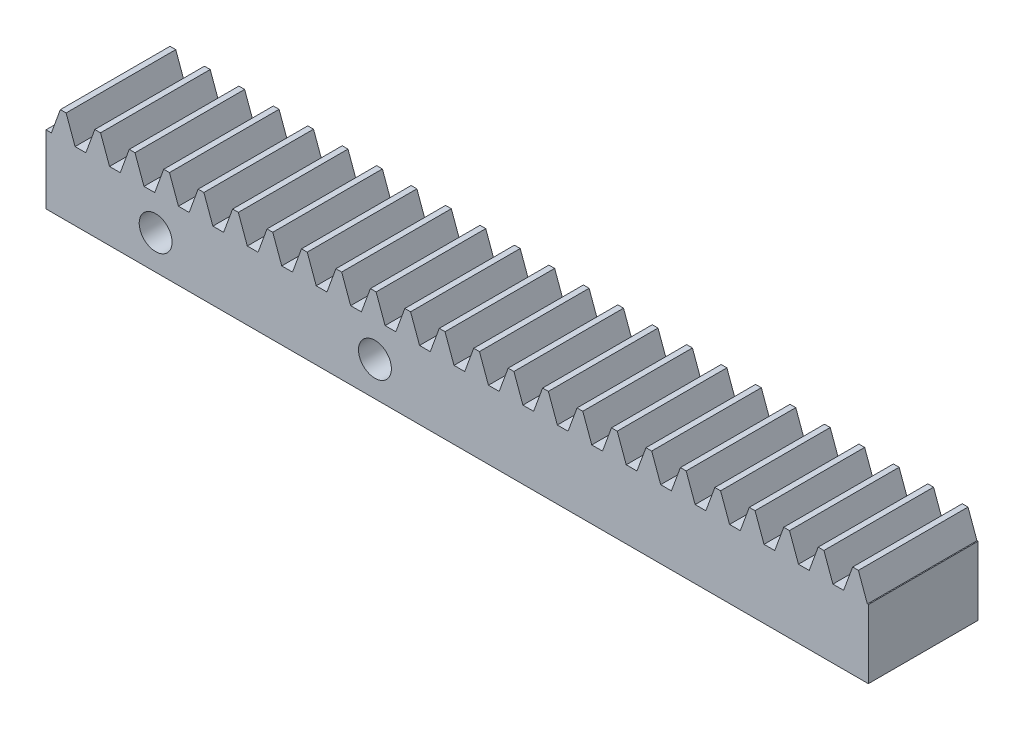
from build123d import *

# Parameters (mm, degrees)
BLANKSKE_W         = 75
BLANKSKE_H         = 8.5
BLANK_DEPTH        = 10
TOOTHCUTSIM_DEPTH  = 77.139674284
TEETHCUTS_COUNT    = 25
TEETHCUTS_PITCH    = 3.14159265
SKETCH1_R          = 1.5
CUT_EXTRUDE1_DEPTH = 10


with BuildPart() as part:
    # BlankSke → Blank (new body)
    with BuildSketch(Plane.XY):
        with Locations((37.5, 4.25)):
            Rectangle(BLANKSKE_W, BLANKSKE_H)
    extrude(amount=-BLANK_DEPTH)

    # TooCutSkeSim → ToothCutSim (cut, through all)
    with BuildSketch(Plane.XY):
        Polygon((0.48943537, 6.25), (-0.48943537, 6.25), (-1.317613241, 8.5254), (1.317613241, 8.5254), align=None)
    toothcutsim = extrude(amount=-TOOTHCUTSIM_DEPTH, mode=Mode.SUBTRACT)

    # TeethCuts: ToothCutSim ×25
    with Locations(*[(i * TEETHCUTS_PITCH, 0, 0) for i in range(1, TEETHCUTS_COUNT)]):
        add(toothcutsim, mode=Mode.SUBTRACT)

    # Sketch1 → Cut-Extrude1 (cut)
    with BuildSketch(Plane.XY):
        with Locations((10, 3.125)):
            Circle(SKETCH1_R)
        with Locations((30, 3.125)):
            Circle(SKETCH1_R)
    extrude(amount=-CUT_EXTRUDE1_DEPTH, mode=Mode.SUBTRACT)


solid = part.part
